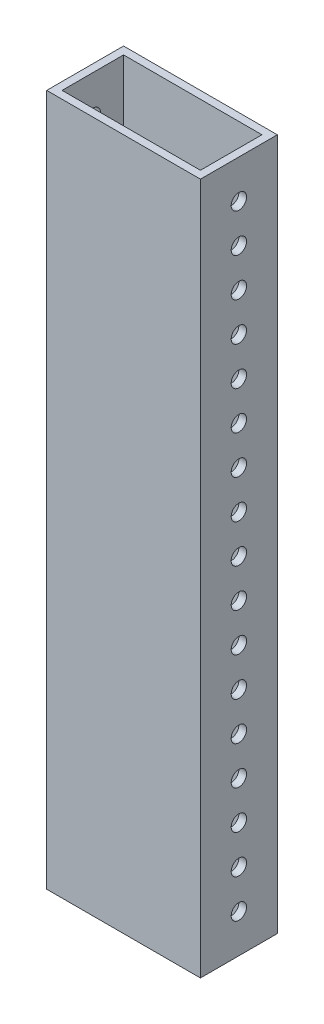
from build123d import *

# Parameters (mm, degrees)
SKETCH1_W           = 50.8
SKETCH1_H           = 25.4
SKETCH1_W_2         = 45.72
SKETCH1_H_2         = 20.32
BOSS_EXTRUDE1_DEPTH = 228.6
SKETCH2_R           = 2.54
CUT_EXTRUDE2_DEPTH  = 228.6


with BuildPart() as part:
    # Sketch1 → Boss-Extrude1 (new body)
    with BuildSketch(Plane(origin=(0, 0, 0), x_dir=(1, 0, 0), z_dir=(0, 1, 0))):
        with Locations((-21.693215127, 7.752354025)):
            Rectangle(SKETCH1_W, SKETCH1_H)
        with Locations((-21.693215127, 7.752354025)):
            Rectangle(SKETCH1_W_2, SKETCH1_H_2, mode=Mode.SUBTRACT)
    extrude(amount=BOSS_EXTRUDE1_DEPTH)

    # Sketch2 → Cut-Extrude2 (cut)
    with BuildSketch(Plane(origin=(3.706784873, 0, 0), x_dir=(0, 0, -1), z_dir=(1, 0, 0))):
        with Locations((7.752354025, 215.9)):
            Circle(SKETCH2_R)
        with Locations((7.752354025, 203.2)):
            Circle(SKETCH2_R)
        with Locations((7.752354025, 190.5)):
            Circle(SKETCH2_R)
        with Locations((7.752354025, 177.8)):
            Circle(SKETCH2_R)
        with Locations((7.752354025, 165.1)):
            Circle(SKETCH2_R)
        with Locations((7.752354025, 152.4)):
            Circle(SKETCH2_R)
        with Locations((7.752354025, 139.7)):
            Circle(SKETCH2_R)
        with Locations((7.752354025, 127)):
            Circle(SKETCH2_R)
        with Locations((7.752354025, 114.3)):
            Circle(SKETCH2_R)
        with Locations((7.752354025, 101.6)):
            Circle(SKETCH2_R)
        with Locations((7.752354025, 88.9)):
            Circle(SKETCH2_R)
        with Locations((7.752354025, 76.2)):
            Circle(SKETCH2_R)
        with Locations((7.752354025, 63.5)):
            Circle(SKETCH2_R)
        with Locations((7.752354025, 50.8)):
            Circle(SKETCH2_R)
        with Locations((7.752354025, 38.1)):
            Circle(SKETCH2_R)
        with Locations((7.752354025, 25.4)):
            Circle(SKETCH2_R)
        with Locations((7.752354025, 12.7)):
            Circle(SKETCH2_R)
    extrude(amount=-CUT_EXTRUDE2_DEPTH, mode=Mode.SUBTRACT)


solid = part.part
